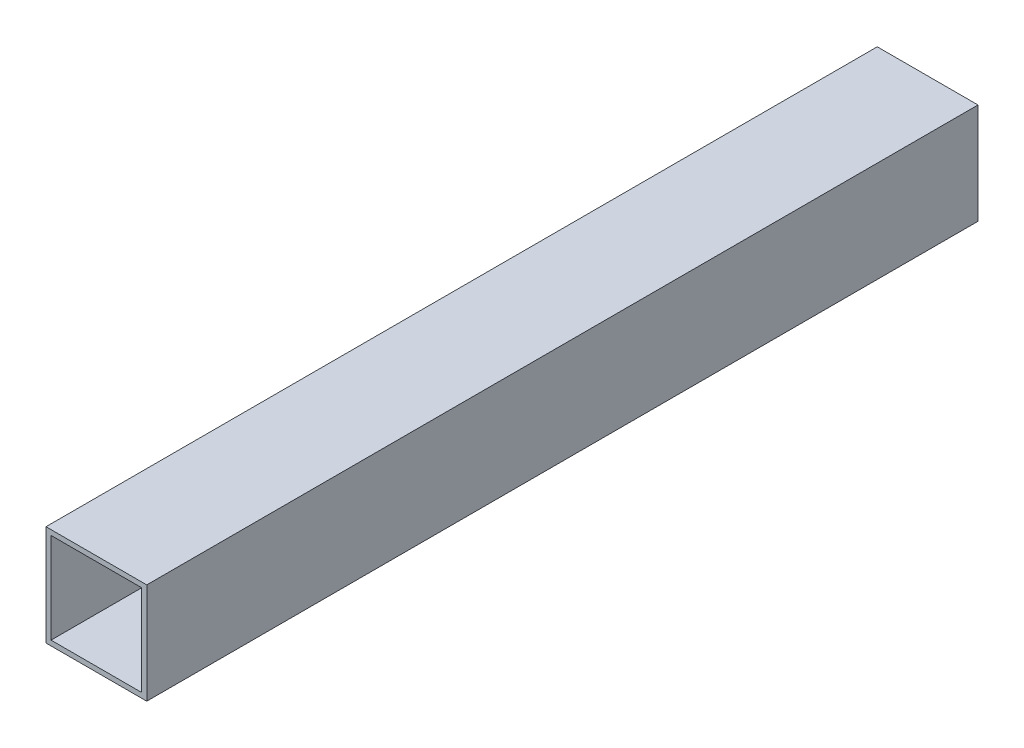
from build123d import *

# Parameters (mm, degrees)
CROQUIS1_W            = 40
CROQUIS1_H            = 40
CROQUIS1_W_2          = 36
CROQUIS1_H_2          = 36
EXTRUIR_L_MINA1_DEPTH = 330


with BuildPart() as part:
    # Croquis1 → Extruir-Lámina1 (new body)
    with BuildSketch(Plane.XY):
        Rectangle(CROQUIS1_W, CROQUIS1_H)
        Rectangle(CROQUIS1_W_2, CROQUIS1_H_2, mode=Mode.SUBTRACT)
    extrude(amount=EXTRUIR_L_MINA1_DEPTH)


solid = part.part
